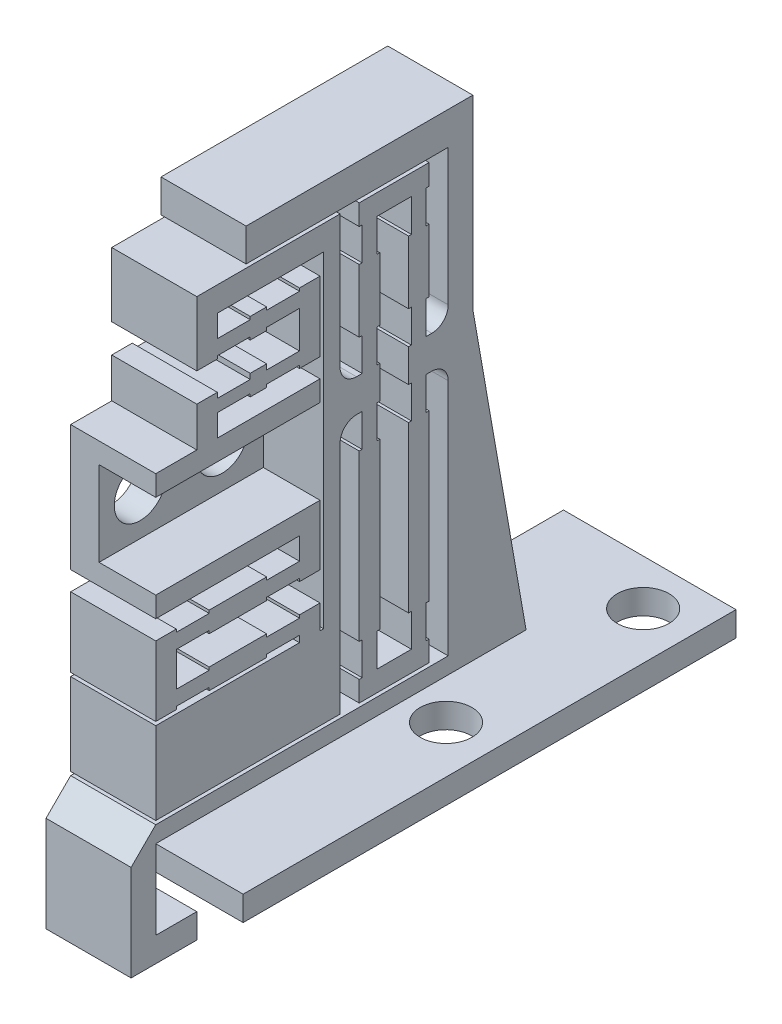
from build123d import *

# Parameters (mm, degrees)
BOSS_EXTRUDE1_DEPTH = 5.18
CUT_EXTRUDE4_REACH  = 45.046
SKETCH2_W           = 3.45
SKETCH2_H           = 5.15
CUT_EXTRUDE3_REACH  = 42.402
SKETCH7_R           = 1.575
SKETCH3_W           = 10.5
SKETCH3_H           = 30
SKETCH3_R           = 1.575
BOSS_EXTRUDE2_DEPTH = 1.5


with BuildPart() as part:
    # Sketch1 → Boss-Extrude1 (new body)
    with BuildSketch(Plane(origin=(0, 0, 0), x_dir=(0, 0, -1), z_dir=(1, 0, 0))):
        with BuildLine():
            Line((-5.5, -10.303333333), (-5.5, -17.953333333))
            Line((-5.5, -17.953333333), (3.25, -17.953333333))
            Line((3.25, -17.953333333), (3.25, -19.295))
            Line((3.25, -19.295), (1.25, -19.295))
            Line((1.25, -19.295), (1.25, -19.12))
            Line((1.25, -19.12), (-2.25, -19.12))
            Line((-2.25, -19.12), (-2.25, -19.295))
            Line((-2.25, -19.295), (-4.25, -19.295))
            Line((-4.25, -19.295), (-4.25, -19.12))
            Line((-4.25, -19.12), (-5.5, -19.12))
            Line((-5.5, -19.12), (-5.5, -23.37))
            Line((-5.5, -23.37), (-4.25, -23.37))
            Line((-4.25, -23.37), (-4.25, -23.195))
            Line((-4.25, -23.195), (-2.25, -23.195))
            Line((-2.25, -23.195), (-2.25, -23.37))
            Line((-2.25, -23.37), (1.25, -23.37))
            Line((1.25, -23.37), (1.25, -23.195))
            Line((1.25, -23.195), (3.25, -23.195))
            Line((3.25, -23.195), (3.25, -23.59))
            Line((3.25, -23.59), (-5.5, -23.59))
            Line((-5.5, -23.59), (-5.5, -28.59))
            Line((-5.5, -28.59), (5.72, -28.59))
            Line((5.72, -28.59), (5.72, -14.303333333))
            ThreePointArc((5.72, -14.303333333), (6.012893219, -13.596226552), (6.72, -13.303333333))
            Line((6.72, -13.303333333), (7.061666667, -13.303333333))
            Line((7.061666667, -13.303333333), (7.061666667, -15.303333333))
            Line((7.061666667, -15.303333333), (6.886666667, -15.303333333))
            Line((6.886666667, -15.303333333), (6.886666667, -25.34))
            Line((6.886666667, -25.34), (7.061666667, -25.34))
            Line((7.061666667, -25.34), (7.061666667, -27.34))
            Line((7.061666667, -27.34), (6.886666667, -27.34))
            Line((6.886666667, -27.34), (6.886666667, -28.59))
            Line((6.886666667, -28.59), (11.136666667, -28.59))
            Line((11.136666667, -28.59), (11.136666667, -27.34))
            Line((11.136666667, -27.34), (10.961666667, -27.34))
            Line((10.961666667, -27.34), (10.961666667, -25.34))
            Line((10.961666667, -25.34), (11.136666667, -25.34))
            Line((11.136666667, -25.34), (11.136666667, -15.303333333))
            Line((11.136666667, -15.303333333), (10.961666667, -15.303333333))
            Line((10.961666667, -15.303333333), (10.961666667, -13.303333333))
            Line((10.961666667, -13.303333333), (11.303333333, -13.303333333))
            ThreePointArc((11.303333333, -13.303333333), (12.010440115, -13.596226552), (12.303333333, -14.303333333))
            Line((12.303333333, -14.303333333), (12.303333333, -28.81))
            Line((12.303333333, -28.81), (-5.5, -28.81))
            Line((-5.5, -28.81), (-7, -30.31))
            Line((-7, -30.31), (-7, -36.14))
            Line((-7, -36.14), (-3, -36.14))
            Line((-3, -36.14), (-3, -34.64))
            Line((-3, -34.64), (-5.5, -34.64))
            Line((-5.5, -34.64), (-5.5, -31.31))
            Line((-5.5, -31.31), (17.303333333, -31.31))
            Line((17.303333333, -31.31), (13.803333333, -11.31))
            Line((13.803333333, -11.31), (13.803333333, 0))
            Line((13.803333333, 0), (0, 0))
            Line((0, 0), (0, -2))
            Line((0, -2), (12.303333333, -2))
            Line((12.303333333, -2), (12.303333333, -10.303333333))
            ThreePointArc((12.303333333, -10.303333333), (12.010440115, -11.010440115), (11.303333333, -11.303333333))
            Line((11.303333333, -11.303333333), (10.961666667, -11.303333333))
            Line((10.961666667, -11.303333333), (10.961666667, -9.303333333))
            Line((10.961666667, -9.303333333), (11.136666667, -9.303333333))
            Line((11.136666667, -9.303333333), (11.136666667, -5.47))
            Line((11.136666667, -5.47), (10.961666667, -5.47))
            Line((10.961666667, -5.47), (10.961666667, -3.47))
            Line((10.961666667, -3.47), (11.136666667, -3.47))
            Line((11.136666667, -3.47), (11.136666667, -2.22))
            Line((11.136666667, -2.22), (6.886666667, -2.22))
            Line((6.886666667, -2.22), (6.886666667, -3.47))
            Line((6.886666667, -3.47), (7.061666667, -3.47))
            Line((7.061666667, -3.47), (7.061666667, -5.47))
            Line((7.061666667, -5.47), (6.886666667, -5.47))
            Line((6.886666667, -5.47), (6.886666667, -9.303333333))
            Line((6.886666667, -9.303333333), (7.061666667, -9.303333333))
            Line((7.061666667, -9.303333333), (7.061666667, -11.303333333))
            Line((7.061666667, -11.303333333), (6.72, -11.303333333))
            ThreePointArc((6.72, -11.303333333), (6.012893219, -11.010440115), (5.72, -10.303333333))
            Line((5.72, -10.303333333), (5.72, -2.22))
            Line((5.72, -2.22), (-3, -2.22))
            Line((-3, -2.22), (-3, -6.136666667))
            Line((-3, -6.136666667), (-1.75, -6.136666667))
            Line((-1.75, -6.136666667), (-1.75, -5.961666667))
            Line((-1.75, -5.961666667), (0.25, -5.961666667))
            Line((0.25, -5.961666667), (0.25, -6.136666667))
            Line((0.25, -6.136666667), (1.25, -6.136666667))
            Line((1.25, -6.136666667), (1.25, -5.961666667))
            Line((1.25, -5.961666667), (3.25, -5.961666667))
            Line((3.25, -5.961666667), (3.25, -8.211666667))
            Line((3.25, -8.211666667), (1.25, -8.211666667))
            Line((1.25, -8.211666667), (1.25, -7.886666667))
            Line((1.25, -7.886666667), (0.25, -7.886666667))
            Line((0.25, -7.886666667), (0.25, -8.211666667))
            Line((0.25, -8.211666667), (-1.75, -8.211666667))
            Line((-1.75, -8.211666667), (-1.75, -7.886666667))
            Line((-1.75, -7.886666667), (-3, -7.886666667))
            Line((-3, -7.886666667), (-3, -10.303333333))
            Line((-3, -10.303333333), (-5.5, -10.303333333))
        make_face()
        Polygon((-1.75, -10.303333333), (4.5, -10.303333333), (4.5, -20.37), (3.25, -20.37), (3.25, -20.195), (1.25, -20.195), (1.25, -20.37), (-2.25, -20.37), (-2.25, -20.195), (-4.25, -20.195), (-4.25, -22.295), (-2.25, -22.295), (-2.25, -22.12), (1.25, -22.12), (1.25, -22.295), (3.25, -22.295), (3.25, -22.12), (4.5, -22.12), (4.5, -23.59), (4.72, -23.59), (4.72, -3.72), (-1.75, -3.72), (-1.75, -5.061666667), (0.25, -5.061666667), (0.25, -4.886666667), (1.25, -4.886666667), (1.25, -5.061666667), (3.25, -5.061666667), (3.25, -4.886666667), (4.5, -4.886666667), (4.5, -9.136666667), (3.25, -9.136666667), (3.25, -8.961666667), (1.25, -8.961666667), (1.25, -9.136666667), (0.25, -9.136666667), (0.25, -8.961666667), (-1.75, -8.961666667), align=None, mode=Mode.SUBTRACT)
        Polygon((10.061666667, -27.34), (7.961666667, -27.34), (7.961666667, -25.34), (8.136666667, -25.34), (8.136666667, -15.303333333), (7.961666667, -15.303333333), (7.961666667, -13.303333333), (8.136666667, -13.303333333), (8.136666667, -11.303333333), (7.961666667, -11.303333333), (7.961666667, -9.303333333), (8.136666667, -9.303333333), (8.136666667, -5.47), (7.961666667, -5.47), (7.961666667, -3.47), (10.061666667, -3.47), (10.061666667, -5.47), (9.886666667, -5.47), (9.886666667, -9.303333333), (10.061666667, -9.303333333), (10.061666667, -11.303333333), (9.886666667, -11.303333333), (9.886666667, -13.303333333), (10.061666667, -13.303333333), (10.061666667, -15.303333333), (9.886666667, -15.303333333), (9.886666667, -25.34), (10.061666667, -25.34), align=None, mode=Mode.SUBTRACT)
    extrude(amount=BOSS_EXTRUDE1_DEPTH)

    # Sketch2 → Cut-Extrude4 (cut, up to next)
    with BuildSketch(Plane.XY.offset(5.5), mode=Mode.PRIVATE) as cut_extrude4_sk1:
        with Locations((3.455, -14.128333333)):
            Rectangle(SKETCH2_W, SKETCH2_H)
    cut_extrude4_tool1 = extrude(cut_extrude4_sk1.sketch, amount=-CUT_EXTRUDE4_REACH, mode=Mode.PRIVATE) & part.part
    add(cut_extrude4_tool1.solids().sort_by_distance((3.455, -14.128333, 5.5))[0], mode=Mode.SUBTRACT)

    # Sketch7 → Cut-Extrude3 (cut, up to next)
    with BuildSketch(Plane.ZY, mode=Mode.PRIVATE) as cut_extrude3_sk1:
        with Locations((3, -14.178333333)):
            Circle(SKETCH7_R)
    cut_extrude3_tool1 = extrude(cut_extrude3_sk1.sketch, amount=-CUT_EXTRUDE3_REACH, mode=Mode.PRIVATE) & part.part
    # Sketch7 → Cut-Extrude3 (cut, up to next)
    with BuildSketch(Plane.ZY, mode=Mode.PRIVATE) as cut_extrude3_sk2:
        with Locations((-2, -14.178333333)):
            Circle(SKETCH7_R)
    cut_extrude3_tool2 = extrude(cut_extrude3_sk2.sketch, amount=-CUT_EXTRUDE3_REACH, mode=Mode.PRIVATE) & part.part
    add(cut_extrude3_tool1.solids().sort_by_distance((0, -14.178333, 3))[0], mode=Mode.SUBTRACT)
    add(cut_extrude3_tool2.solids().sort_by_distance((0, -14.178333, -2))[0], mode=Mode.SUBTRACT)

    # Sketch3 → Boss-Extrude2 (add)
    with BuildSketch(Plane.XZ.offset(31.31)):
        with Locations((5.25, -9.5)):
            Rectangle(SKETCH3_W, SKETCH3_H)
        with Locations(Location((7.62, -9.73, 0), (0, 0, 270))):
            Circle(SKETCH3_R, mode=Mode.SUBTRACT)
        with Locations(Location((7.62, -21.73, 0), (0, 0, 270))):
            Circle(SKETCH3_R, mode=Mode.SUBTRACT)
    extrude(amount=-BOSS_EXTRUDE2_DEPTH)


solid = part.part
